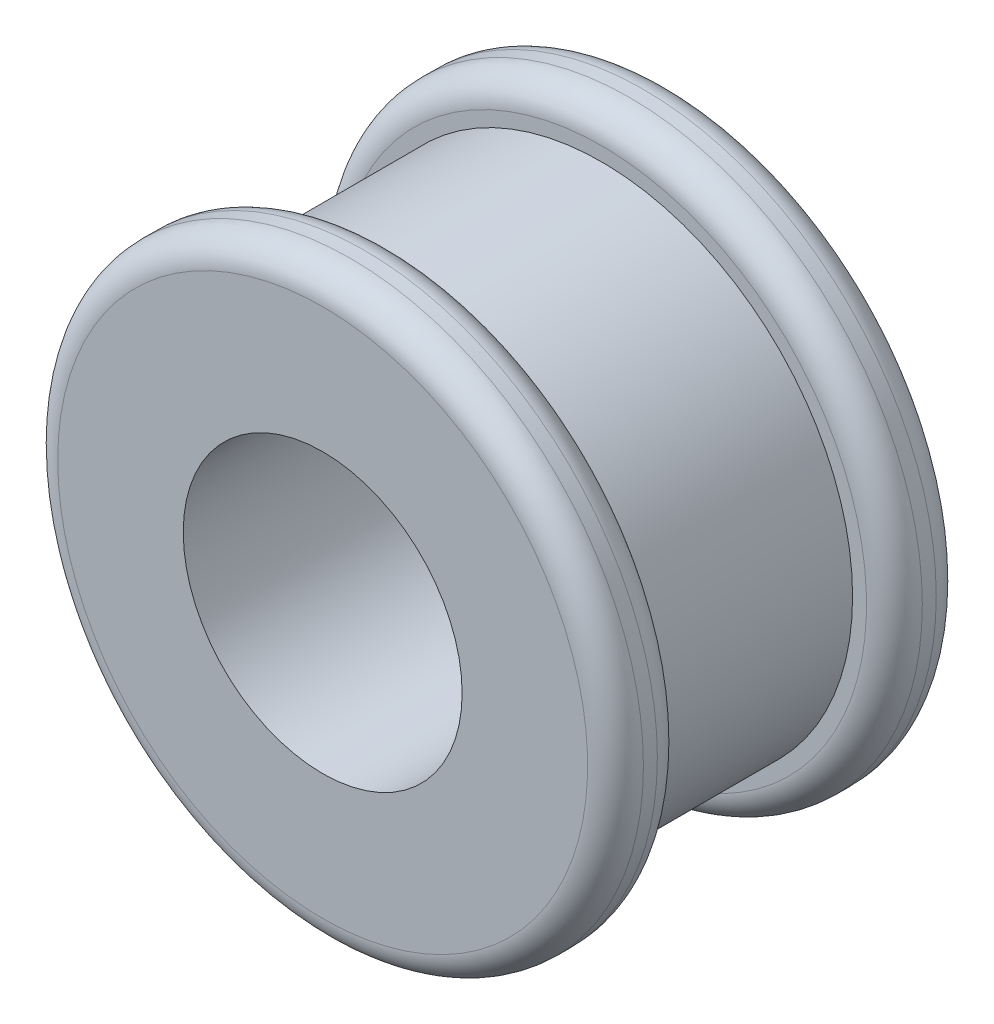
from build123d import *

# Parameters (mm, degrees)
FILLET1_R = 2


with BuildPart() as part:
    # Sketch1 → Revolve1 (revolve)
    with BuildSketch(Plane(origin=(0, 0, 0), x_dir=(0, 0, -1), z_dir=(1, 0, 0)), mode=Mode.PRIVATE) as revolve1_sk:
        Polygon((0, 10), (25, 10), (25, 21), (20, 21), (20, 18), (5, 18), (5, 21), (0, 21), align=None)
    revolve(revolve1_sk.sketch.rotate(Axis((0, 0, 0), (0, 0, -1)), 90), axis=Axis((0, 0, 0), (0, 0, -1)))

    # Fillet1
    fillet1_edges = [part.edges().sort_by_distance(p)[0] for p in [
        (-21, 0, 0),
        (-21, 0, -5),
        (-21, 0, -20),
        (-21, 0, -25),
    ]]
    fillet(fillet1_edges, radius=FILLET1_R)


solid = part.part
